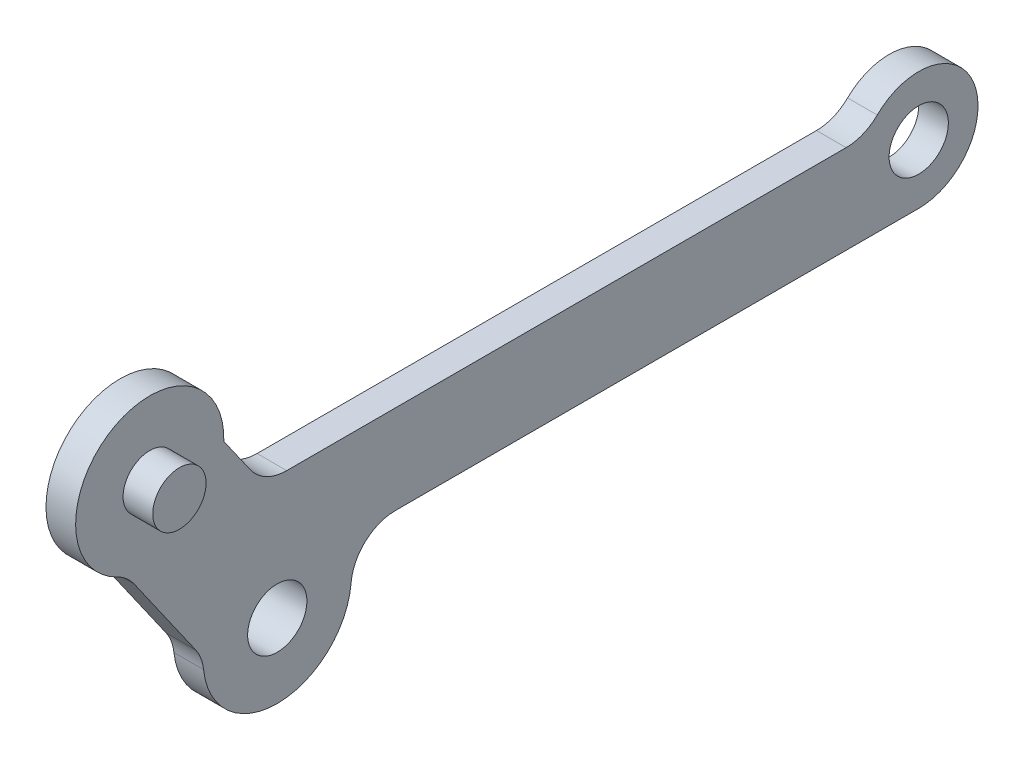
from build123d import *

# Parameters (mm, degrees)
EXTRUDE_1_DEPTH          = 2
SKETCH_1_4_R             = 3
EXTRUDE_2_DEPTH          = 2
CUT_EXTRUDE_1_DEPTH      = 51.040969284
CUT_EXTRUDE_1_DEPTH_BACK = 51.040969284
SKETCH_1_3_R             = 2
FILLET_1_R               = 3
EXTRUDE_START            = -2
SKETCH_2_R               = 2
EXTRUDE_3_DEPTH          = 2
SKETCH_2_3_R             = 1.8
EXTRUDE_4_DEPTH          = 2


with BuildPart() as part:
    # 草图1 → 凸台-拉伸1 (new body)
    with BuildSketch(Plane(origin=(0, 0, 0), x_dir=(0, 0, -1), z_dir=(1, 0, 0))):
        with BuildLine():
            Line((40.737143614, 0), (0, 0))
            Line((0, 0), (2.48051592, -3.542543867))
            ThreePointArc((2.48051592, -3.542543867), (4.165783411, -4.487079684), (5.367176995, -6))
            Line((5.367176995, -6), (44.201245229, -6))
            ThreePointArc((44.201245229, -6), (40.737143614, -4), (40.737143614, 0))
        make_face()
        with BuildLine():
            Line((2.48051592, -3.542543867), (0, 0))
            Line((0, 0), (-2.681672007, 3.829824531))
            ThreePointArc((-2.681672007, 3.829824531), (-4.811127311, -0.102785303), (-9.234888361, -0.758786959))
            Line((-9.234888361, -0.758786959), (-4.072700434, -8.131155358))
            ThreePointArc((-4.072700434, -8.131155358), (-1.94324513, -4.198545524), (2.48051592, -3.542543867))
        make_face()
        with BuildLine():
            ThreePointArc((48.201245229, -2), (45.23652141, 1.863703305), (40.737143614, 0))
            Line((40.737143614, 0), (44.201245229, 0))
            ThreePointArc((44.201245229, 0), (45.615458792, -0.585786438), (46.201245229, -2))
            ThreePointArc((46.201245229, -2), (45.615458792, -3.414213562), (44.201245229, -4))
            Line((44.201245229, -4), (44.201245229, -6))
            ThreePointArc((44.201245229, -6), (47.029672354, -4.828427125), (48.201245229, -2))
        make_face()
        with BuildLine():
            Line((44.201245229, 0), (40.737143614, 0))
            ThreePointArc((40.737143614, 0), (40.737143614, -4), (44.201245229, -6))
            Line((44.201245229, -6), (44.201245229, -4))
            ThreePointArc((44.201245229, -4), (42.201245229, -2), (44.201245229, 0))
        make_face()
        with BuildLine():
            ThreePointArc((5.367176995, -6), (4.165783411, -4.487079684), (2.48051592, -3.542543867))
            Line((2.48051592, -3.542543867), (4.201245229, -6))
            Line((4.201245229, -6), (5.367176995, -6))
        make_face()
        with BuildLine():
            Line((4.201245229, -6), (2.48051592, -3.542543867))
            ThreePointArc((2.48051592, -3.542543867), (-1.94324513, -4.198545524), (-4.072700434, -8.131155358))
            Line((-4.072700434, -8.131155358), (-2.351971125, -10.588611491))
            Line((-2.351971125, -10.588611491), (-1.532819081, -10.015035054))
            ThreePointArc((-1.532819081, -10.015035054), (-0.796092257, -5.836849613), (3.382093185, -6.573576436))
            Line((3.382093185, -6.573576436), (4.201245229, -6))
        make_face()
        with BuildLine():
            ThreePointArc((-9.234888361, -0.758786959), (-4.811127311, -0.102785303), (-2.681672007, 3.829824531))
            Line((-2.681672007, 3.829824531), (-4.402401316, 6.287280664))
            Line((-4.402401316, 6.287280664), (-6.040705405, 5.140127792))
            ThreePointArc((-6.040705405, 5.140127792), (-5.771575592, 4.594386518), (-5.679009493, 3.992974919))
            ThreePointArc((-5.679009493, 3.992974919), (-7.077597894, 2.085541017), (-9.317313582, 2.845822046))
            Line((-9.317313582, 2.845822046), (-10.95561767, 1.698669174))
            Line((-10.95561767, 1.698669174), (-9.234888361, -0.758786959))
        make_face()
        with BuildLine():
            Line((-4.402401316, 6.287280664), (-2.681672007, 3.829824531))
            ThreePointArc((-2.681672007, 3.829824531), (-2.679675166, 3.911388863), (-2.679009493, 3.992974919))
            ThreePointArc((-2.679009493, 3.992974919), (-10.613341245, 8.041394014), (-9.234888361, -0.758786959))
            Line((-9.234888361, -0.758786959), (-10.95561767, 1.698669174))
            Line((-10.95561767, 1.698669174), (-9.317313582, 2.845822046))
            ThreePointArc((-9.317313582, 2.845822046), (-8.826162366, 5.631279008), (-6.040705405, 5.140127792))
            Line((-6.040705405, 5.140127792), (-4.402401316, 6.287280664))
        make_face()
        with BuildLine():
            ThreePointArc((46.201245229, -2), (45.615458792, -0.585786438), (44.201245229, 0))
            Line((44.201245229, 0), (44.201245229, -4))
            ThreePointArc((44.201245229, -4), (45.615458792, -3.414213562), (46.201245229, -2))
        make_face()
        with BuildLine():
            Line((44.201245229, -4), (44.201245229, 0))
            ThreePointArc((44.201245229, 0), (42.201245229, -2), (44.201245229, -4))
        make_face()
        with BuildLine():
            Line((5.367176995, -6), (4.201245229, -6))
            Line((4.201245229, -6), (3.382093185, -6.573576436))
            ThreePointArc((3.382093185, -6.573576436), (3.785787904, -7.392188347), (3.924637052, -8.294305745))
            ThreePointArc((3.924637052, -8.294305745), (1.826754451, -11.155456598), (-1.532819081, -10.015035054))
            Line((-1.532819081, -10.015035054), (-2.351971125, -10.588611491))
            Line((-2.351971125, -10.588611491), (-4.072700434, -8.131155358))
            ThreePointArc((-4.072700434, -8.131155358), (0.843050996, -13.293640073), (5.924637052, -8.294305745))
            ThreePointArc((5.924637052, -8.294305745), (5.783273678, -7.113776143), (5.367176995, -6))
        make_face()
        with BuildLine():
            ThreePointArc((3.924637052, -8.294305745), (3.785787904, -7.392188347), (3.382093185, -6.573576436))
            Line((3.382093185, -6.573576436), (2.562941141, -7.147152873))
            ThreePointArc((2.562941141, -7.147152873), (2.832070954, -7.692894146), (2.924637052, -8.294305745))
            ThreePointArc((2.924637052, -8.294305745), (1.526048651, -10.201739647), (-0.713667036, -9.441458618))
            Line((-0.713667036, -9.441458618), (-1.532819081, -10.015035054))
            ThreePointArc((-1.532819081, -10.015035054), (1.826754451, -11.155456598), (3.924637052, -8.294305745))
        make_face()
        with BuildLine():
            Line((2.562941141, -7.147152873), (3.382093185, -6.573576436))
            ThreePointArc((3.382093185, -6.573576436), (-0.796092257, -5.836849613), (-1.532819081, -10.015035054))
            Line((-1.532819081, -10.015035054), (-0.713667036, -9.441458618))
            ThreePointArc((-0.713667036, -9.441458618), (-0.222515821, -6.656001657), (2.562941141, -7.147152873))
        make_face()
        with BuildLine():
            ThreePointArc((-5.679009493, 3.992974919), (-5.771575592, 4.594386518), (-6.040705405, 5.140127792))
            Line((-6.040705405, 5.140127792), (-9.317313582, 2.845822046))
            ThreePointArc((-9.317313582, 2.845822046), (-7.077597894, 2.085541017), (-5.679009493, 3.992974919))
        make_face()
        with BuildLine():
            Line((-9.317313582, 2.845822046), (-6.040705405, 5.140127792))
            ThreePointArc((-6.040705405, 5.140127792), (-8.826162366, 5.631279008), (-9.317313582, 2.845822046))
        make_face()
        with BuildLine():
            ThreePointArc((2.924637052, -8.294305745), (2.832070954, -7.692894146), (2.562941141, -7.147152873))
            Line((2.562941141, -7.147152873), (-0.713667036, -9.441458618))
            ThreePointArc((-0.713667036, -9.441458618), (1.526048651, -10.201739647), (2.924637052, -8.294305745))
        make_face()
        with BuildLine():
            Line((-0.713667036, -9.441458618), (2.562941141, -7.147152873))
            ThreePointArc((2.562941141, -7.147152873), (-0.222515821, -6.656001657), (-0.713667036, -9.441458618))
        make_face()
    extrude(amount=EXTRUDE_1_DEPTH)

    # 草图1<4> → 凸台-拉伸2 (add)
    with BuildSketch(Plane(origin=(0, 0, 0), x_dir=(0, 0, -1), z_dir=(1, 0, 0))):
        with Locations((0.924637052, -8.294305745)):
            Circle(SKETCH_1_4_R)
    extrude(amount=-EXTRUDE_2_DEPTH)

    # 草图1<3> → 切除-拉伸1 (cut, two sides: drawn at the far end of the back side and taken through both)
    with BuildSketch(Plane(origin=(0, 0, 0), x_dir=(0, 0, -1), z_dir=(1, 0, 0)).offset(-CUT_EXTRUDE_1_DEPTH_BACK)):
        with Locations((-7.679009493, 3.992974919)):
            Circle(SKETCH_1_3_R)
        with Locations((44.201245229, -2)):
            Circle(SKETCH_1_3_R)
        with Locations((0.924637052, -8.294305745)):
            Circle(SKETCH_1_3_R)
    extrude(amount=CUT_EXTRUDE_1_DEPTH + CUT_EXTRUDE_1_DEPTH_BACK, mode=Mode.SUBTRACT)

    # 圆角1
    fillet_1_edges = [part.edges().sort_by_distance(p)[0] for p in [
        (1, -6, -5.367176995),
        (1, 0, 0),
        (1, 0, -40.737143614),
        (1, -0.758786959, 9.234888361),
        (1, -8.131155358, 4.072700434),
    ]]
    fillet(fillet_1_edges, radius=FILLET_1_R)

    # 草图2 → 凸台-拉伸3 (add)
    with BuildSketch(Plane(origin=(2, 0, 0), x_dir=(0, 0, -1), z_dir=(1, 0, 0)).offset(EXTRUDE_START)):
        with Locations((-7.679009493, 3.992974919)):
            Circle(SKETCH_2_R)
    extrude(amount=EXTRUDE_3_DEPTH)

    # 草图2<3> → 凸台-拉伸4 (add)
    with BuildSketch(Plane(origin=(2, 0, 0), x_dir=(0, 0, -1), z_dir=(1, 0, 0))):
        with Locations((-7.679009493, 3.992974919)):
            Circle(SKETCH_2_3_R)
    extrude(amount=EXTRUDE_4_DEPTH)


solid = part.part
